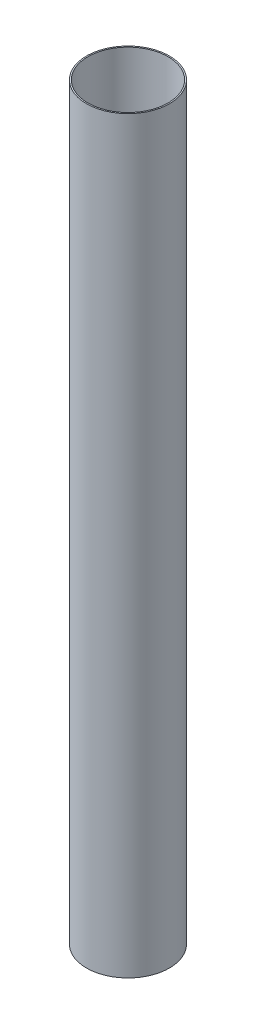
from build123d import *

# Parameters (mm, degrees)
SKETCH1_R            = 39.37
SKETCH1_R_2          = 38.1
TUBE_EXTRUSION_DEPTH = 711.2


with BuildPart() as part:
    # Sketch1 → Tube Extrusion (new body)
    with BuildSketch(Plane(origin=(0, 0, 0), x_dir=(1, 0, 0), z_dir=(0, 1, 0))):
        with Locations(Location((0, 0, 0), (0, 0, 270))):
            Circle(SKETCH1_R)
        with Locations(Location((0, 0, 0), (0, 0, 270))):
            Circle(SKETCH1_R_2, mode=Mode.SUBTRACT)
    extrude(amount=TUBE_EXTRUSION_DEPTH)


solid = part.part
